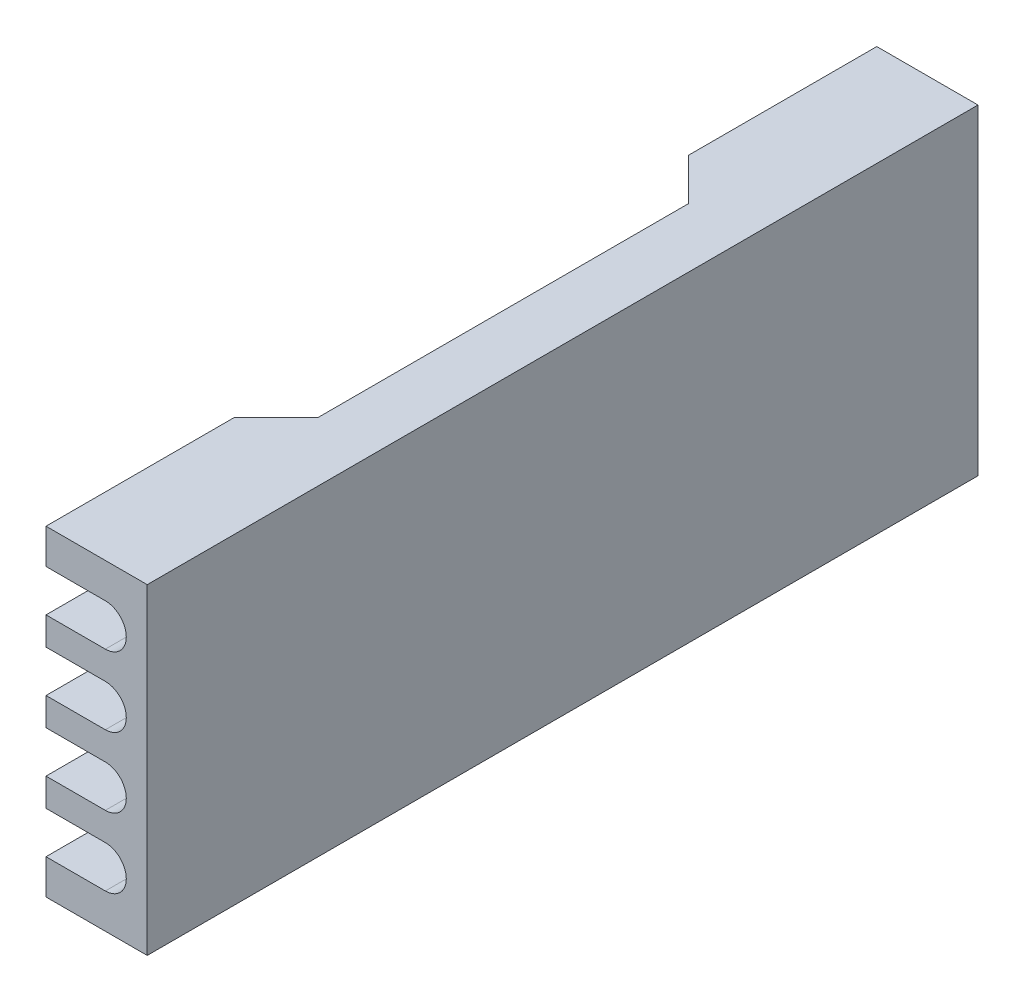
from build123d import *

# Parameters (mm, degrees)
SKETCH1_W                = 26.67
SKETCH1_H                = 10.668
BOSS_EXTRUDE1_DEPTH      = 0.254
EXTRUDE_THIN1_DEPTH      = 0.254
EXTRUDE_THIN1_DEPTH_BACK = 2.921
SKETCH1_3_W              = 27.686
SKETCH1_3_H              = 11.684
SKETCH1_3_W_2            = 26.67
SKETCH1_3_H_2            = 10.668
SKETCH5_W                = 1.27
SKETCH5_H                = 11.684
BOSS_EXTRUDE2_DEPTH      = 3.683
CUT_EXTRUDE1_DEPTH       = 31.975766028
LPATTERN1_COUNT          = 4
LPATTERN1_PITCH          = 2.54
CUT_EXTRUDE2_DEPTH       = 20.408159779


with BuildPart() as part:
    # Sketch1 → Boss-Extrude1 (new body)
    with BuildSketch(Plane(origin=(0, 0, 0), x_dir=(0, 0, -1), z_dir=(1, 0, 0))):
        Rectangle(SKETCH1_W, SKETCH1_H)
    extrude(amount=BOSS_EXTRUDE1_DEPTH)

    # Sketch1<3> → Extrude-Thin1 (add, two sides: drawn at the far end of the back side and taken through both)
    with BuildSketch(Plane(origin=(0, 0, 0), x_dir=(0, 0, -1), z_dir=(1, 0, 0)).offset(-EXTRUDE_THIN1_DEPTH_BACK)):
        Rectangle(SKETCH1_3_W, SKETCH1_3_H)
        Rectangle(SKETCH1_3_W_2, SKETCH1_3_H_2, mode=Mode.SUBTRACT)
    extrude(amount=EXTRUDE_THIN1_DEPTH + EXTRUDE_THIN1_DEPTH_BACK)

    # Sweep1: sweep along a path in Sketch2
    with BuildLine(Plane.ZY.offset(2.921)) as sweep1_path:
        Line((-13.335, -5.334), (13.335, -5.334))
        Line((13.335, -5.334), (13.335, 5.334))
        Line((13.335, 5.334), (-13.335, 5.334))
        Line((-13.335, 5.334), (-13.335, -5.334))
    # Sketch3 → Sweep1 (sweep)
    with BuildSketch(Plane(origin=(0, 0, 0), x_dir=(-1, 0, 0), z_dir=(0, -1, 0))):
        Polygon((2.921, -13.335), (3.140970453, -12.954), (3.429, -13.242029547), (3.429, -13.843), (2.921, -13.843), align=None)
    sweep(path=sweep1_path.line, transition=Transition.RIGHT)

    # Sketch5 → Boss-Extrude2 (add)
    with BuildSketch(Plane.ZY.offset(3.429)):
        with Locations((-14.478, 0)):
            Rectangle(SKETCH5_W, SKETCH5_H)
        with Locations((14.478, 0)):
            Rectangle(SKETCH5_W, SKETCH5_H)
    extrude(amount=-BOSS_EXTRUDE2_DEPTH)

    # Sketch4 → Cut-Extrude1 (cut, symmetric)
    with BuildSketch(Plane.XY.offset(15.113)):
        with BuildLine():
            Line((-1.27, 4.572), (-3.429, 4.572))
            Line((-3.429, 4.572), (-3.429, 3.048))
            Line((-3.429, 3.048), (-1.27, 3.048))
            ThreePointArc((-1.27, 3.048), (-0.508, 3.81), (-1.27, 4.572))
        make_face()
    cut_extrude1 = extrude(amount=CUT_EXTRUDE1_DEPTH, both=True, mode=Mode.SUBTRACT)

    # LPattern1: Cut-Extrude1 ×4
    with Locations(*[(0, -i * LPATTERN1_PITCH, 0) for i in range(1, LPATTERN1_COUNT)]):
        add(cut_extrude1, mode=Mode.SUBTRACT)

    # Sketch7 → Cut-Extrude2 (cut, through all)
    with BuildSketch(Plane.XZ.offset(5.842)):
        Polygon((-3.429, 8.255), (-1.905, 6.731), (-1.905, -6.731), (-3.429, -8.255), align=None)
    extrude(amount=-CUT_EXTRUDE2_DEPTH, mode=Mode.SUBTRACT)


solid = part.part
